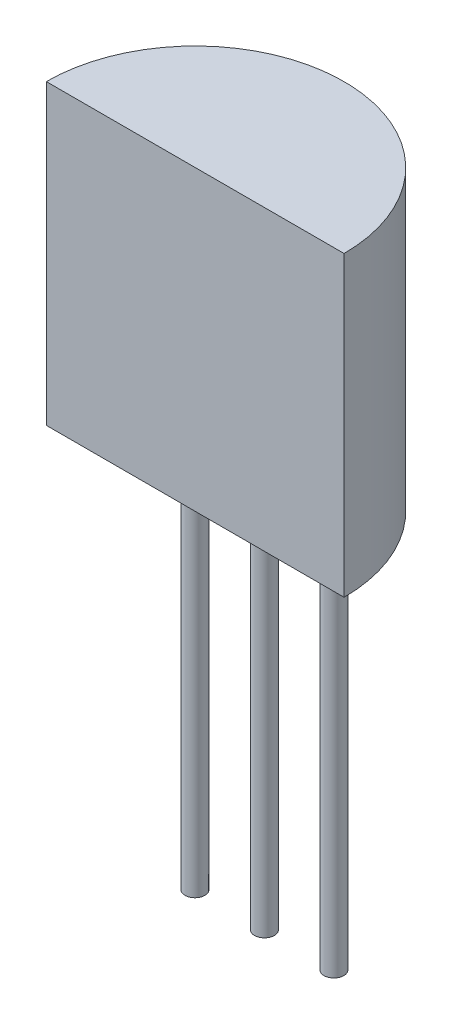
from build123d import *

# Parameters (mm, degrees)
Y_KSEKLIK_EKSTR_ZYON1_DEPTH = 15
IZIM4_R                     = 3
KES_EKSTR_ZYON1_DEPTH       = 2
IZIM8_R                     = 0.5
IZIM10_R                    = 0.5
IZIM11_R                    = 0.5


with BuildPart() as part:
    # Çizim1 → Yükseklik-Ekstrüzyon1 (new body)
    with BuildSketch(Plane(origin=(0, 0, 0), x_dir=(1, 0, 0), z_dir=(0, 1, 0))):
        with BuildLine():
            Line((0, 0), (15, 0))
            ThreePointArc((15, 0), (7.5, 7.5), (0, 0))
        make_face()
    extrude(amount=Y_KSEKLIK_EKSTR_ZYON1_DEPTH)

    # Çizim4 → Kes-Ekstrüzyon1 (cut)
    with BuildSketch(Plane(origin=(7.5, 15, -7.5), x_dir=(-1, 0, 0), z_dir=(0, 0, -1))):
        with Locations((0, -7.5)):
            Circle(IZIM4_R)
    extrude(amount=-KES_EKSTR_ZYON1_DEPTH, mode=Mode.SUBTRACT)

    # Süpür1: sweep along a curve in space
    with BuildLine() as s_p_r1_path:
        Line((11, 0, -3.488617215), (11, -20, -3.488617215))
    # Çizim8 → Süpür1 (sweep)
    with BuildSketch(Plane(origin=(4, -20, -3.488617215), x_dir=(-1, 0, 0), z_dir=(0, -1, 0))):
        with Locations((-7, 0)):
            Circle(IZIM8_R)
    sweep(path=s_p_r1_path.line)

    # Süpür2: sweep along a curve in space
    with BuildLine() as s_p_r2_path:
        Line((7.5, 0, -3.488617215), (7.5, -20, -3.488617215))
    # Çizim10 → Süpür2 (sweep)
    with BuildSketch(Plane(origin=(4, -20, -3.488617215), x_dir=(-1, 0, 0), z_dir=(0, -1, 0))):
        with Locations((-3.5, 0)):
            Circle(IZIM10_R)
    sweep(path=s_p_r2_path.line)

    # Süpür3: sweep along a curve in space
    with BuildLine() as s_p_r3_path:
        Line((4, 0, -3.488617215), (4, -20, -3.488617215))
    # Çizim11 → Süpür3 (sweep)
    with BuildSketch(Plane(origin=(4, -20, -3.488617215), x_dir=(-1, 0, 0), z_dir=(0, -1, 0))):
        Circle(IZIM11_R)
    sweep(path=s_p_r3_path.line)


solid = part.part
